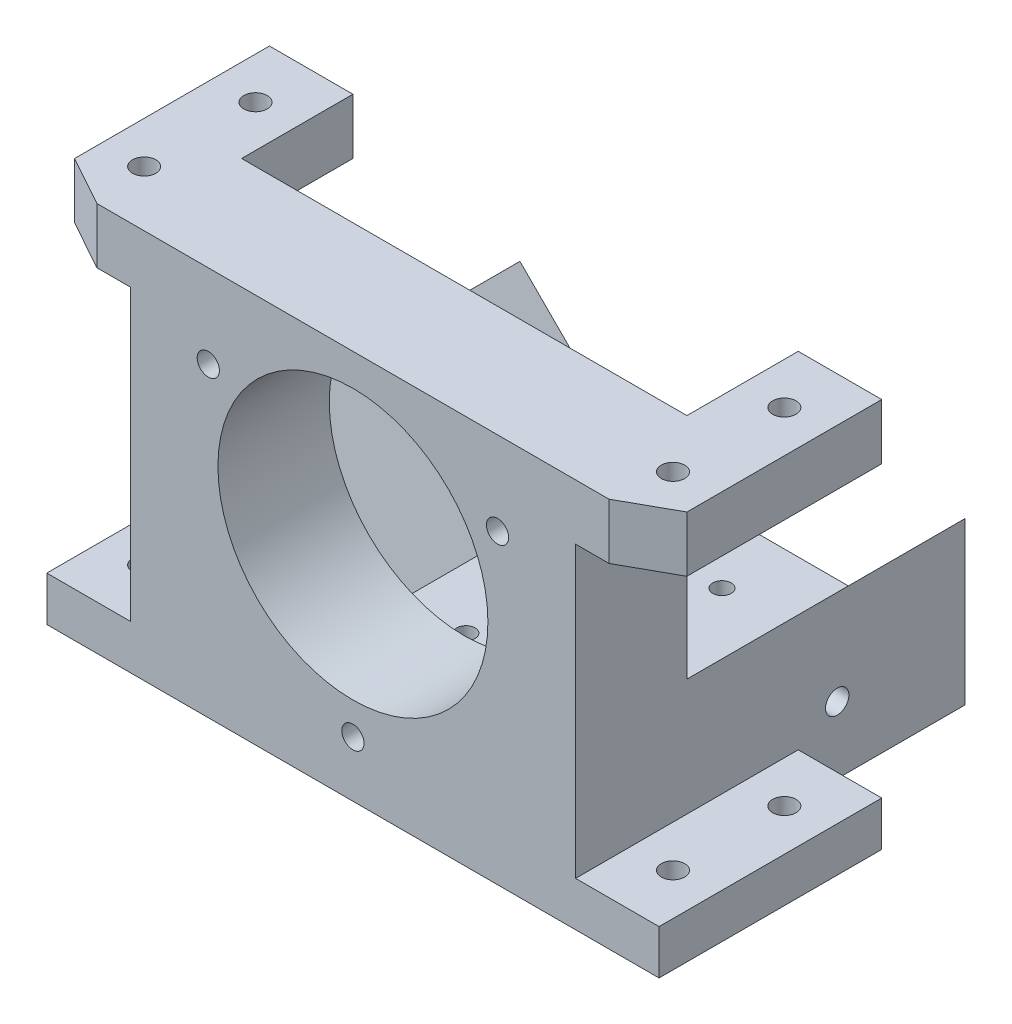
from build123d import *

# Parameters (mm, degrees)
SKETCH1_W           = 80
SKETCH1_H           = 60
SKETCH1_R           = 24.25
BOSS_EXTRUDE1_DEPTH = 20
BOSS_EXTRUDE3_DEPTH = 15
SKETCH5_R           = 2.1
CUT_EXTRUDE2_DEPTH  = 10
SKETCH6_W           = 80
SKETCH6_H           = 20
BOSS_EXTRUDE4_DEPTH = 2
BOSS_EXTRUDE6_DEPTH = 50
SKETCH9_R           = 2.1
CUT_EXTRUDE3_DEPTH  = 100.619275243
SKETCH12_W          = 80
SKETCH12_H          = 70
SKETCH12_R          = 1.65
BOSS_EXTRUDE8_DEPTH = 8
BOSS_EXTRUDE9_DEPTH = 15
CUT_EXTRUDE4_START  = -10
SKETCH14_R          = 2.1
CUT_EXTRUDE4_DEPTH  = 10
SKETCH16_R          = 2
CUT_EXTRUDE5_DEPTH  = 3
CIRPATTERN1_COUNT   = 3


with BuildPart() as part:
    # Sketch1 → Boss-Extrude1 (new body)
    with BuildSketch(Plane.XY):
        Rectangle(SKETCH1_W, SKETCH1_H)
        Circle(SKETCH1_R, mode=Mode.SUBTRACT)
    extrude(amount=BOSS_EXTRUDE1_DEPTH)

    # Sketch4 → Boss-Extrude3 (add)
    with BuildSketch(Plane(origin=(40, 0, 0), x_dir=(0, 0, -1), z_dir=(1, 0, 0))):
        Polygon((-20, 30), (0, 30), (20, 30), (20, 20), (0, 20), (-20, 20), align=None)
    boss_extrude3 = extrude(amount=BOSS_EXTRUDE3_DEPTH)

    # Sketch5 → Cut-Extrude2 (cut)
    with BuildSketch(Plane(origin=(0, 30, 0), x_dir=(1, 0, 0), z_dir=(0, 1, 0))):
        with Locations(Location((47.5, -10, 0), (0, 0, 270))):
            Circle(SKETCH5_R)
        with Locations(Location((47.5, 10, 0), (0, 0, 270))):
            Circle(SKETCH5_R)
        Polygon((46, -20), (55, -15), (55, -20), align=None)
    cut_extrude2 = extrude(amount=-CUT_EXTRUDE2_DEPTH, mode=Mode.SUBTRACT)

    # Sketch6 → Boss-Extrude4 (add)
    with BuildSketch(Plane(origin=(0, -30, 0), x_dir=(-1, 0, 0), z_dir=(0, -1, 0))):
        with Locations((0, -10)):
            Rectangle(SKETCH6_W, SKETCH6_H)
    boss_extrude4 = extrude(amount=BOSS_EXTRUDE4_DEPTH)

    # Sketch8 → Boss-Extrude6 (add)
    with BuildSketch(Plane(origin=(0, 0, 0), x_dir=(-1, 0, 0), z_dir=(0, 0, -1))):
        Polygon((-40, -11), (-19, -32), (-40, -32), align=None)
    boss_extrude6 = extrude(amount=BOSS_EXTRUDE6_DEPTH)

    # Sketch9 → Cut-Extrude3 (cut, through all)
    with BuildSketch(Plane(origin=(40, 0, 0), x_dir=(0, 0, -1), z_dir=(1, 0, 0))):
        with Locations((27, -28)):
            Circle(SKETCH9_R)
    cut_extrude3 = extrude(amount=-CUT_EXTRUDE3_DEPTH, mode=Mode.SUBTRACT)

    # Sketch12 → Boss-Extrude8 (add)
    with BuildSketch(Plane.XZ.offset(32)):
        with Locations((0, -15)):
            Rectangle(SKETCH12_W, SKETCH12_H)
        with Locations(Location((-8, -8.3, 0), (0, 0, 270))):
            Circle(SKETCH12_R, mode=Mode.SUBTRACT)
        with Locations(Location((8, -8.3, 0), (0, 0, 270))):
            Circle(SKETCH12_R, mode=Mode.SUBTRACT)
        with Locations(Location((8, -38.3, 0), (0, 0, 270))):
            Circle(SKETCH12_R, mode=Mode.SUBTRACT)
        with Locations(Location((-8, -38.3, 0), (0, 0, 270))):
            Circle(SKETCH12_R, mode=Mode.SUBTRACT)
    extrude(amount=BOSS_EXTRUDE8_DEPTH)

    # Mirror1: Boss-Extrude3, Cut-Extrude2, Boss-Extrude4, Boss-Extrude6, Cut-Extrude3 across plane
    add(boss_extrude3.mirror(Plane(origin=(0, 0, 0), x_dir=(0, 0, 1), z_dir=(1, 0, 0))))
    add(cut_extrude2.mirror(Plane(origin=(0, 0, 0), x_dir=(0, 0, 1), z_dir=(1, 0, 0))), mode=Mode.SUBTRACT)
    add(boss_extrude4.mirror(Plane(origin=(0, 0, 0), x_dir=(0, 0, 1), z_dir=(1, 0, 0))))
    add(boss_extrude6.mirror(Plane(origin=(0, 0, 0), x_dir=(0, 0, 1), z_dir=(1, 0, 0))))
    add(cut_extrude3.mirror(Plane(origin=(0, 0, 0), x_dir=(0, 0, 1), z_dir=(1, 0, 0))), mode=Mode.SUBTRACT)

    # Sketch13 → Boss-Extrude9 (add)
    with BuildSketch(Plane.ZY.offset(40)):
        Polygon((20, -40), (0, -40), (-20, -40), (-20, -32), (0, -32), (20, -32), align=None)
    boss_extrude9 = extrude(amount=BOSS_EXTRUDE9_DEPTH)

    # Sketch14 → Cut-Extrude4 (cut)
    with BuildSketch(Plane.XZ.offset(40).offset(CUT_EXTRUDE4_START)):
        with Locations(Location((-47.5, 10, 0), (0, 0, 90))):
            Circle(SKETCH14_R)
        with Locations(Location((-47.5, -10, 0), (0, 0, 90))):
            Circle(SKETCH14_R)
    cut_extrude4 = extrude(amount=CUT_EXTRUDE4_DEPTH, mode=Mode.SUBTRACT)

    # Mirror2: Boss-Extrude9, Cut-Extrude4 across plane
    add(boss_extrude9.mirror(Plane(origin=(0, 0, 0), x_dir=(0, 0, 1), z_dir=(1, 0, 0))))
    add(cut_extrude4.mirror(Plane(origin=(0, 0, 0), x_dir=(0, 0, 1), z_dir=(1, 0, 0))), mode=Mode.SUBTRACT)

    # Sketch16 → Cut-Extrude5 (cut)
    with BuildSketch(Plane.XY.offset(20)):
        with Locations((0, -30)):
            Circle(SKETCH16_R)
    cut_extrude5 = extrude(amount=-CUT_EXTRUDE5_DEPTH, mode=Mode.SUBTRACT)

    # CirPattern1: Cut-Extrude5 ×3 about axis
    cirpattern1_axis = Axis((0, 0, 0), (0, 0, 1))
    for i in range(1, CIRPATTERN1_COUNT):
        add(cut_extrude5.rotate(cirpattern1_axis, i * 360 / CIRPATTERN1_COUNT), mode=Mode.SUBTRACT)


solid = part.part
